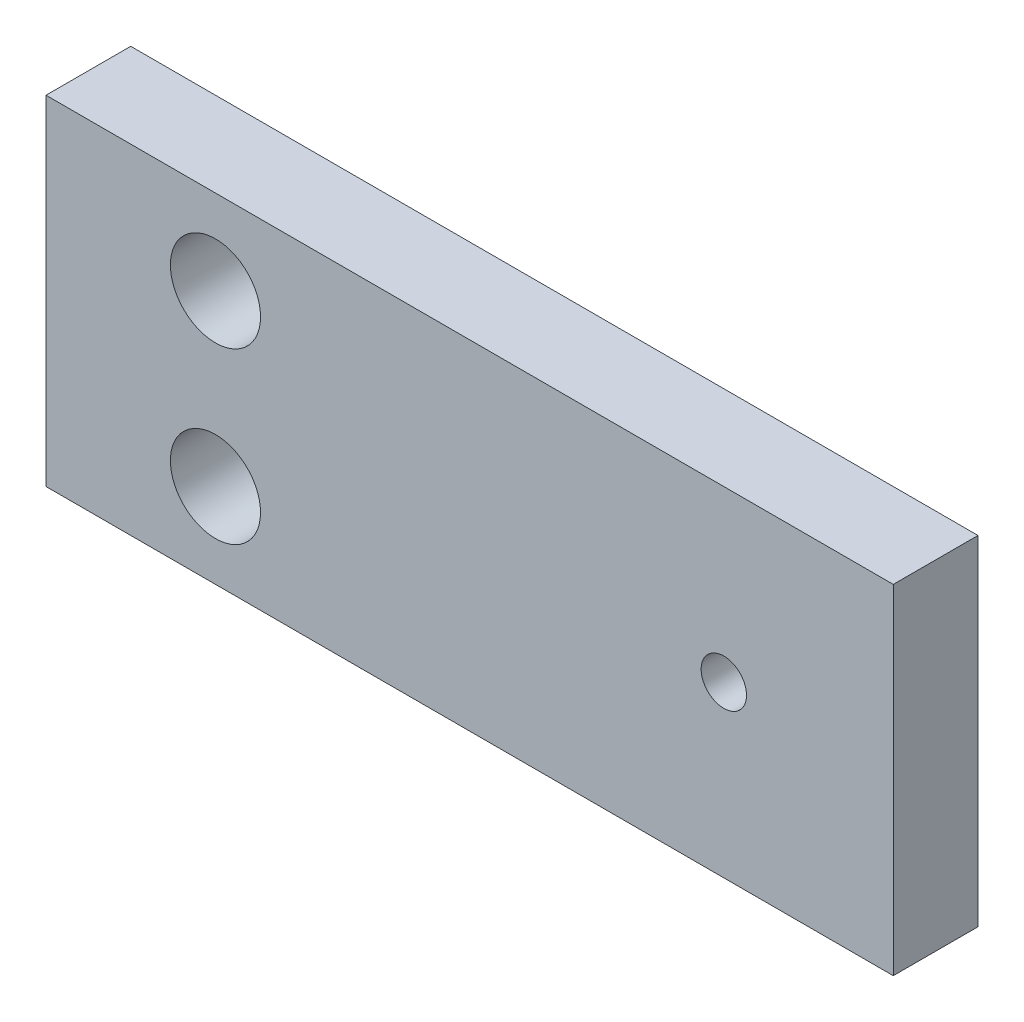
from build123d import *

# Parameters (mm, degrees)
SKETCH1_W               = 63.5
SKETCH1_H               = 25.4
BOSS_EXTRUDE1_DEPTH     = 6.35
F_1_4_CLEARANCE_HOLE1_D = 6.7564
M3_CLEARANCE_HOLE1_D    = 3.4


with BuildPart() as part:
    # Sketch1 → Boss-Extrude1 (new body)
    with BuildSketch(Plane.XY):
        with Locations((31.75, 12.7)):
            Rectangle(SKETCH1_W, SKETCH1_H)
    extrude(amount=BOSS_EXTRUDE1_DEPTH)

    # 1/4 Clearance Hole1 (through all)
    with Locations(Plane.XY.offset(6.35)):
        with Locations((12.7, 6.35), (12.7, 19.05)):
            Hole(F_1_4_CLEARANCE_HOLE1_D / 2)

    # M3 Clearance Hole1 (through all)
    with Locations(Plane.XY.offset(6.35)):
        with Locations((50.8, 12.7)):
            Hole(M3_CLEARANCE_HOLE1_D / 2)


solid = part.part
